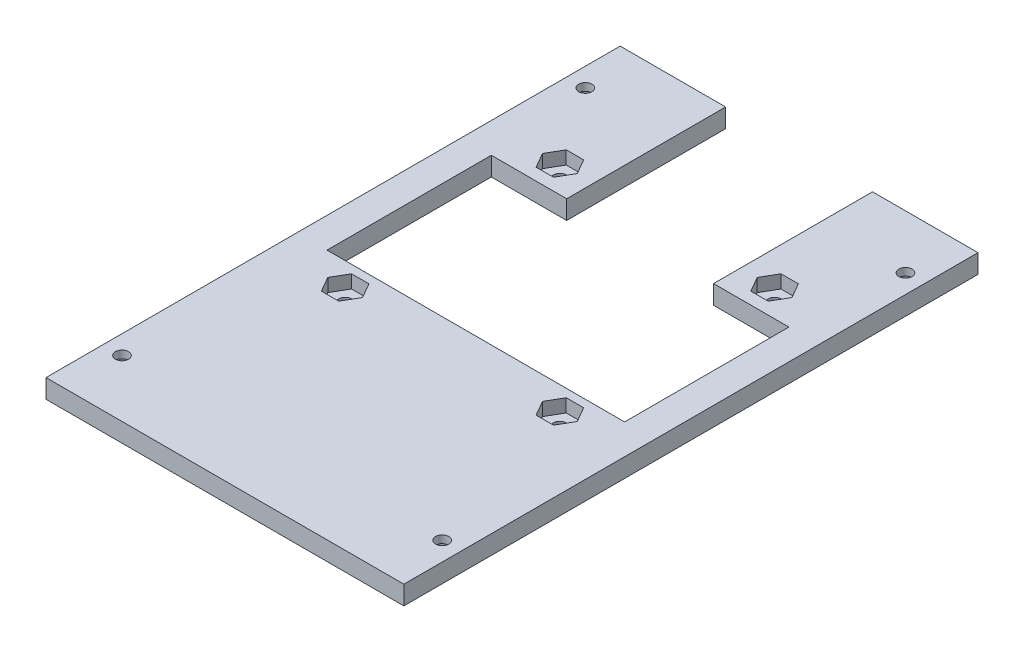
from build123d import *

# Parameters (mm, degrees)
SKETCH1_W           = 95
SKETCH1_H           = 152.42
BOSS_EXTRUDE1_DEPTH = 5
SKETCH2_R           = 1.75
CUT_EXTRUDE1_DEPTH  = 10
SKETCH3_R           = 3.5
CUT_EXTRUDE2_DEPTH  = 3
CUT_EXTRUDE3_DEPTH  = 10
SKETCH4_R           = 1.75
CUT_EXTRUDE4_DEPTH  = 10
CUT_EXTRUDE5_DEPTH  = 3.5


with BuildPart() as part:
    # Sketch1 → Boss-Extrude1 (new body)
    with BuildSketch(Plane(origin=(0, 0, 0), x_dir=(1, 0, 0), z_dir=(0, 1, 0))):
        Rectangle(SKETCH1_W, SKETCH1_H)
    extrude(amount=BOSS_EXTRUDE1_DEPTH)

    # Sketch2 → Cut-Extrude1 (cut)
    with BuildSketch(Plane.XZ):
        with Locations(Location((42.5, -61.96, 0), (0, 0, 270))):
            Circle(SKETCH2_R)
        with Locations(Location((-42.5, -61.96, 0), (0, 0, 270))):
            Circle(SKETCH2_R)
        with Locations(Location((-42.5, 61.04, 0), (0, 0, 270))):
            Circle(SKETCH2_R)
        with Locations(Location((42.5, 61.04, 0), (0, 0, 270))):
            Circle(SKETCH2_R)
    extrude(amount=-CUT_EXTRUDE1_DEPTH, mode=Mode.SUBTRACT)

    # Sketch3 → Cut-Extrude2 (cut)
    with BuildSketch(Plane.XZ):
        with Locations(Location((42.5, -61.96, 0), (0, 0, 270))):
            Circle(SKETCH3_R)
        with Locations(Location((42.5, 61.04, 0), (0, 0, 270))):
            Circle(SKETCH3_R)
        with Locations(Location((-42.5, 61.04, 0), (0, 0, 270))):
            Circle(SKETCH3_R)
        with Locations(Location((-42.5, -61.96, 0), (0, 0, 270))):
            Circle(SKETCH3_R)
    extrude(amount=-CUT_EXTRUDE2_DEPTH, mode=Mode.SUBTRACT)

    # Sketch5 → Cut-Extrude3 (cut)
    with BuildSketch(Plane.XZ):
        Polygon((39.5, -34.01), (19.5, -34.01), (19.5, -76.21), (-19.5, -76.21), (-19.5, -34.01), (-39.5, -34.01), (-39.5, 9.61), (39.5, 9.61), align=None)
    extrude(amount=-CUT_EXTRUDE3_DEPTH, mode=Mode.SUBTRACT)

    # Sketch4 → Cut-Extrude4 (cut)
    with BuildSketch(Plane.XZ):
        with Locations(Location((28.5, -41.21, 0), (0, 0, 270))):
            Circle(SKETCH4_R)
        with Locations(Location((28.5, 15.79, 0), (0, 0, 270))):
            Circle(SKETCH4_R)
        with Locations(Location((-28.5, 15.79, 0), (0, 0, 270))):
            Circle(SKETCH4_R)
        with Locations(Location((-28.5, -41.21, 0), (0, 0, 270))):
            Circle(SKETCH4_R)
    extrude(amount=-CUT_EXTRUDE4_DEPTH, mode=Mode.SUBTRACT)

    # Sketch6 → Cut-Extrude5 (cut)
    with BuildSketch(Plane(origin=(0, 5, 0), x_dir=(1, 0, 0), z_dir=(0, 1, 0))):
        Polygon((-26.190598923, 45.21), (-30.809401077, 45.21), (-33.118802154, 41.21), (-30.809401077, 37.21), (-26.190598923, 37.21), (-23.881197846, 41.21), align=None)
        Polygon((30.809401077, 45.21), (26.190598923, 45.21), (23.881197846, 41.21), (26.190598923, 37.21), (30.809401077, 37.21), (33.118802154, 41.21), align=None)
        Polygon((30.809401077, -11.79), (26.190598923, -11.79), (23.881197846, -15.79), (26.190598923, -19.79), (30.809401077, -19.79), (33.118802154, -15.79), align=None)
        Polygon((-26.190598923, -19.79), (-23.881197846, -15.79), (-26.190598923, -11.79), (-30.809401077, -11.79), (-33.118802154, -15.79), (-30.809401077, -19.79), align=None)
    extrude(amount=-CUT_EXTRUDE5_DEPTH, mode=Mode.SUBTRACT)


solid = part.part
